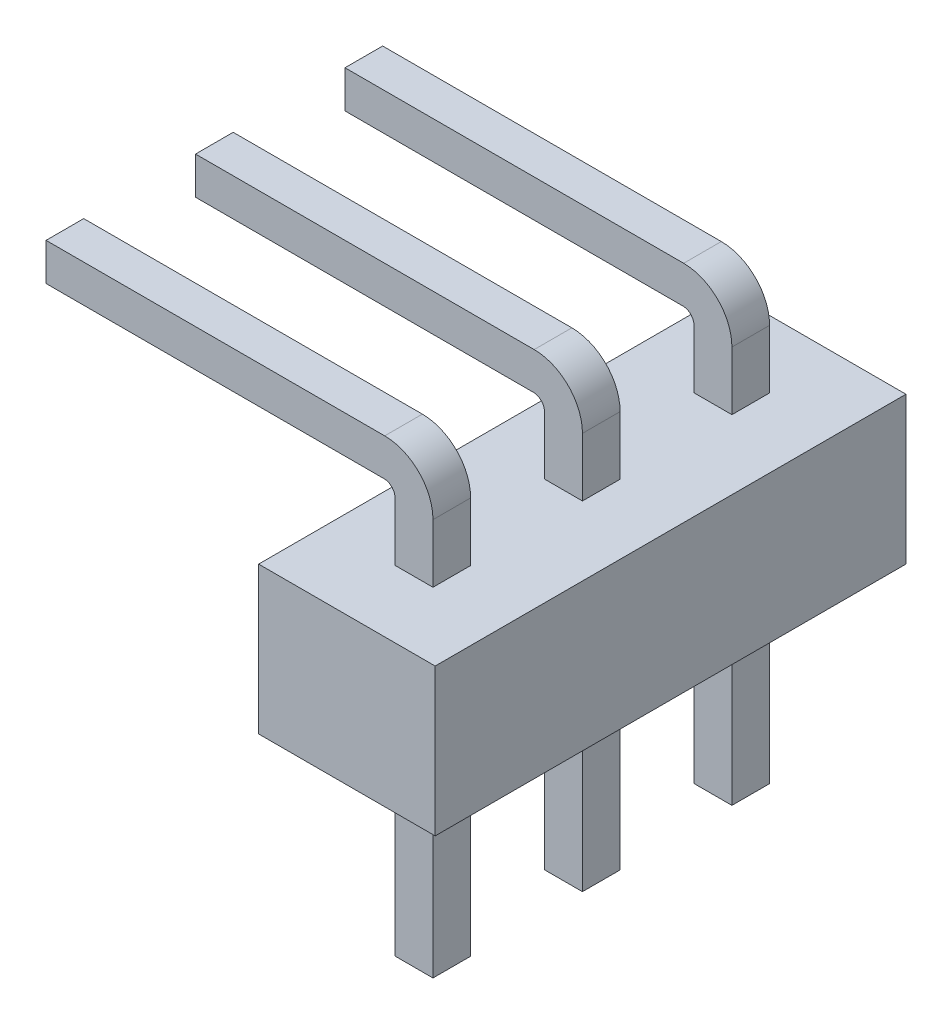
from build123d import *

# Parameters (mm, degrees)
SKETCH1_W       = 3
SKETCH1_H       = 2.5
EXTRUDE1_DEPTH  = 4
SKETCH2_W       = 0.645
SKETCH2_H       = 3.5
EXTRUDE2_DEPTH  = 0.64
LPATTERN1_COUNT = 3
LPATTERN1_PITCH = 2.54
CHAMFER1_SIZE   = 0.25


with BuildPart() as part:
    # Sketch1 → Extrude1 (new, symmetric)
    with BuildSketch(Plane.XY):
        Rectangle(SKETCH1_W, SKETCH1_H)
    extrude(amount=EXTRUDE1_DEPTH, both=True)

    # Sketch2 → Extrude2 (add)
    with BuildSketch(Plane.XY.offset(2.86)):
        with BuildLine():
            Line((-0.3225, 1.25), (-0.3225, 2.245))
            ThreePointArc((-0.3225, 2.245), (-0.374776878, 2.375), (-0.5025, 2.43261663))
            Line((-0.5025, 2.43261663), (-6.5025, 2.43261663))
            Line((-6.5025, 2.43261663), (-6.5025, 3.06831282))
            Line((-6.5025, 3.06831282), (-0.4975, 3.06831282))
            ThreePointArc((-0.4975, 3.06831282), (0.082527742, 2.826), (0.3225, 2.245))
            Line((0.3225, 2.245), (0.3225, 1.25))
            Line((0.3225, 1.25), (-0.3225, 1.25))
        make_face()
        with Locations((0, -3)):
            Rectangle(SKETCH2_W, SKETCH2_H)
    extrude2 = extrude(amount=-EXTRUDE2_DEPTH)

    # LPattern1: Extrude2 ×3
    with Locations(*[(0, 0, -i * LPATTERN1_PITCH) for i in range(1, LPATTERN1_COUNT)]):
        add(extrude2)

    # Chamfer1
    chamfer1_edges = [part.edges().sort_by_distance(p)[0] for p in [
        (-6.5025, 2.750464725, 2.22),
        (-6.5025, 2.43261663, 2.54),
        (-6.5025, 3.06831282, 2.54),
        (-6.5025, 2.750464725, 2.86),
        (0, -4.75, 2.22),
        (0.3225, -4.75, 2.54),
        (-0.3225, -4.75, 2.54),
        (0, -4.75, 2.86),
        (-6.5025, 2.750464725, -0.32),
        (-6.5025, 2.43261663, 0),
        (-6.5025, 3.06831282, 0),
        (-6.5025, 2.750464725, 0.32),
        (0, -4.75, -0.32),
        (0.3225, -4.75, 0),
        (-0.3225, -4.75, 0),
        (0, -4.75, 0.32),
        (-6.5025, 2.750464725, -2.86),
        (-6.5025, 2.43261663, -2.54),
        (-6.5025, 3.06831282, -2.54),
        (-6.5025, 2.750464725, -2.22),
        (0, -4.75, -2.86),
        (0.3225, -4.75, -2.54),
        (-0.3225, -4.75, -2.54),
        (0, -4.75, -2.22),
    ]]
    chamfer(chamfer1_edges, length=CHAMFER1_SIZE)


solid = part.part
